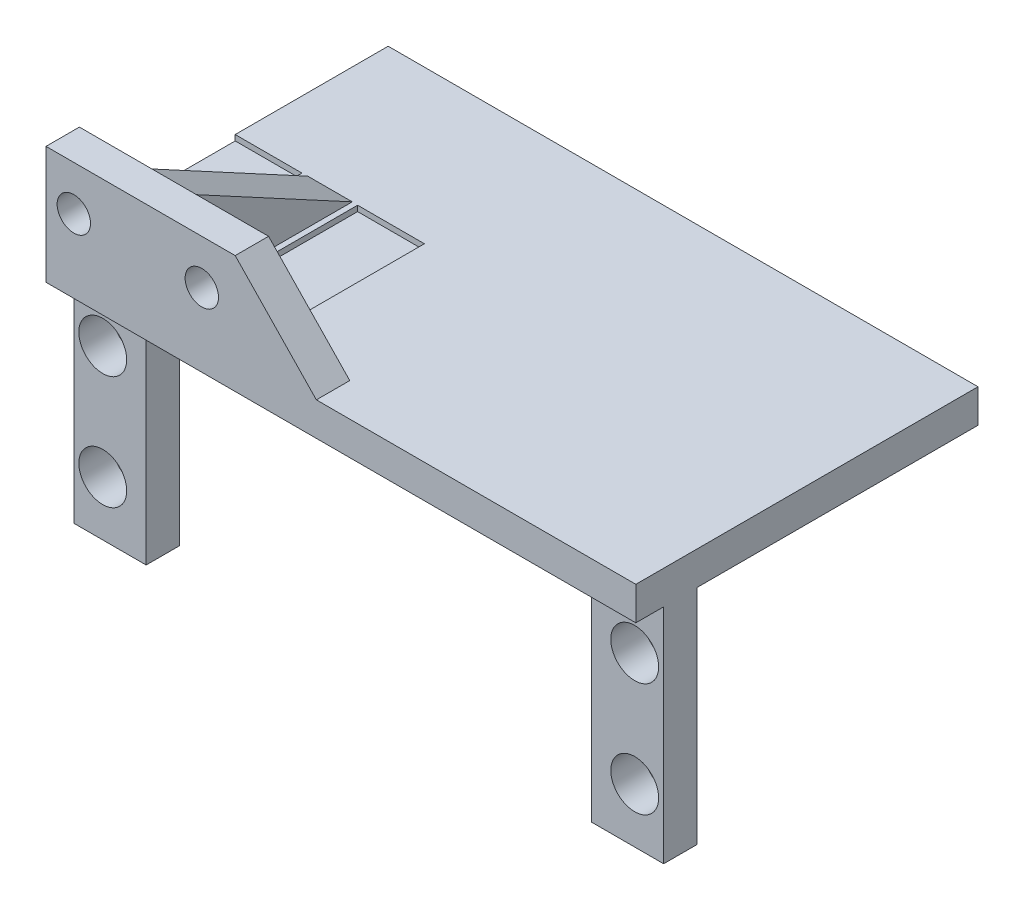
from build123d import *

# Parameters (mm, degrees)
SKETCH1_W                = 53
SKETCH1_H                = 30.745586227
BOSS_EXTRUDE1_DEPTH      = 3
SKETCH2_W                = 6.5
SKETCH2_H                = 3
BOSS_EXTRUDE2_DEPTH      = 20
SKETCH3_R                = 2.15
CUT_EXTRUDE1_DEPTH       = 3
SKETCH6_W                = 17
SKETCH6_H                = 7.58
BOSS_EXTRUDE3_DEPTH      = 3
SKETCH7_R                = 1.5
CUT_EXTRUDE2_DEPTH       = 7.5
SKETCH8_W                = 6
SKETCH8_H                = 14
CUT_EXTRUDE3_DEPTH       = 0.5
BOSS_EXTRUDE4_DEPTH      = 2
BOSS_EXTRUDE4_DEPTH_BACK = 2
BOSS_EXTRUDE5_DEPTH      = 3


with BuildPart() as part:
    # Sketch1 → Boss-Extrude1 (new body)
    with BuildSketch(Plane(origin=(0, 0, 0), x_dir=(1, 0, 0), z_dir=(0, 1, 0))):
        with Locations((24.118089155, -22.118099476)):
            Rectangle(SKETCH1_W, SKETCH1_H)
    extrude(amount=BOSS_EXTRUDE1_DEPTH)

    # Sketch2 → Boss-Extrude2 (add)
    with BuildSketch(Plane.XZ):
        with Locations((47.368089155, 33.49089259)):
            Rectangle(SKETCH2_W, SKETCH2_H)
        with Locations((0.868089155, 33.49089259)):
            Rectangle(SKETCH2_W, SKETCH2_H)
    extrude(amount=BOSS_EXTRUDE2_DEPTH)

    # Sketch3 → Cut-Extrude1 (cut)
    with BuildSketch(Plane.XY.offset(34.99089259)):
        with Locations((48.018089155, -15.1)):
            Circle(SKETCH3_R)
        with Locations((48.018089155, -4.9)):
            Circle(SKETCH3_R)
        with Locations((0.218089155, -15.1)):
            Circle(SKETCH3_R)
        with Locations((0.218089155, -4.9)):
            Circle(SKETCH3_R)
    extrude(amount=-CUT_EXTRUDE1_DEPTH, mode=Mode.SUBTRACT)

    # Sketch6 → Boss-Extrude3 (add)
    with BuildSketch(Plane.XY.offset(37.49089259)):
        with Locations((6.118089155, 6.79)):
            Rectangle(SKETCH6_W, SKETCH6_H)
    extrude(amount=-BOSS_EXTRUDE3_DEPTH)

    # Sketch7 → Cut-Extrude2 (cut)
    with BuildSketch(Plane.XY.offset(37.49089259)):
        with Locations((0.118089155, 6.58)):
            Circle(SKETCH7_R)
        with Locations((11.618089155, 6.58)):
            Circle(SKETCH7_R)
    extrude(amount=-CUT_EXTRUDE2_DEPTH, mode=Mode.SUBTRACT)

    # Sketch8 → Cut-Extrude3 (cut)
    with BuildSketch(Plane(origin=(0, 3, 0), x_dir=(1, 0, 0), z_dir=(0, 1, 0))):
        with Locations((11.618089155, -27.49089259)):
            Rectangle(SKETCH8_W, SKETCH8_H)
        with Locations((0.618089155, -27.49089259)):
            Rectangle(SKETCH8_W, SKETCH8_H)
    extrude(amount=-CUT_EXTRUDE3_DEPTH, mode=Mode.SUBTRACT)

    # Sketch13 → Boss-Extrude4 (add, two sides: drawn at the far end of the back side and taken through both)
    with BuildSketch(Plane.ZY.offset(-6.118089155).offset(-BOSS_EXTRUDE4_DEPTH_BACK)):
        Polygon((34.49089259, 10.57033397), (34.49089259, 3), (20.468920989, 3), align=None)
    extrude(amount=BOSS_EXTRUDE4_DEPTH + BOSS_EXTRUDE4_DEPTH_BACK)

    # Sketch14 → Boss-Extrude5 (add)
    with BuildSketch(Plane.XY.offset(37.49089259)):
        Polygon((14.618089155, 3), (14.618089155, 10.58), (21.91210821, 3), align=None)
    extrude(amount=-BOSS_EXTRUDE5_DEPTH)


solid = part.part
